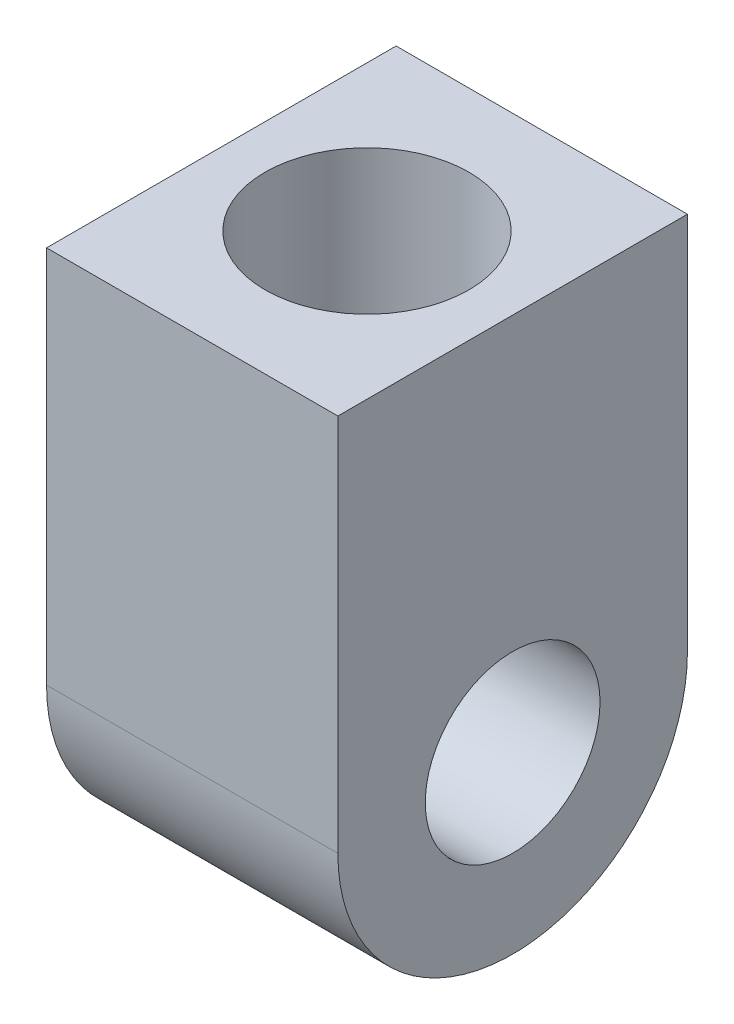
from build123d import *

# Parameters (mm, degrees)
SKETCH_1_R          = 6
SKETCH_1_R_2        = 3
EXTRUDE_1_DEPTH     = 10
SKETCH_2_W          = 10
SKETCH_2_H          = 12
SKETCH_2_R          = 3.5
EXTRUDE_2_DEPTH     = 13
CUT_EXTRUDE_START   = -13
SKETCH_4_R          = 3
CUT_EXTRUDE_1_DEPTH = 13
CUT_EXTRUDE_START_2 = -8.5
SKETCH_5_R          = 3.5
CUT_EXTRUDE_2_DEPTH = 8.5


with BuildPart() as part:
    # 草图1 → 凸台-拉伸1 (new body)
    with BuildSketch(Plane(origin=(0, 0, 0), x_dir=(0, 0, -1), z_dir=(1, 0, 0))):
        Circle(SKETCH_1_R)
        Circle(SKETCH_1_R_2, mode=Mode.SUBTRACT)
    extrude(amount=EXTRUDE_1_DEPTH)

    # 草图2 → 凸台-拉伸2 (add)
    with BuildSketch(Plane(origin=(0, 0, 0), x_dir=(1, 0, 0), z_dir=(0, 1, 0))):
        with Locations((5, 0)):
            Rectangle(SKETCH_2_W, SKETCH_2_H)
        with Locations(Location((5, 0, 0), (0, 0, 90))):
            Circle(SKETCH_2_R, mode=Mode.SUBTRACT)
    extrude(amount=EXTRUDE_2_DEPTH)

    # 草图4 → 切除-拉伸1 (cut)
    with BuildSketch(Plane(origin=(10, 0, 0), x_dir=(0, 0, -1), z_dir=(1, 0, 0)).offset(CUT_EXTRUDE_START)):
        Circle(SKETCH_4_R)
    extrude(amount=CUT_EXTRUDE_1_DEPTH, mode=Mode.SUBTRACT)

    # 草图5 → 切除-拉伸2 (cut)
    with BuildSketch(Plane(origin=(0, 13, 0), x_dir=(1, 0, 0), z_dir=(0, 1, 0)).offset(CUT_EXTRUDE_START_2)):
        with Locations(Location((5, 0, 0), (0, 0, 90))):
            Circle(SKETCH_5_R)
    extrude(amount=CUT_EXTRUDE_2_DEPTH, mode=Mode.SUBTRACT)


solid = part.part
